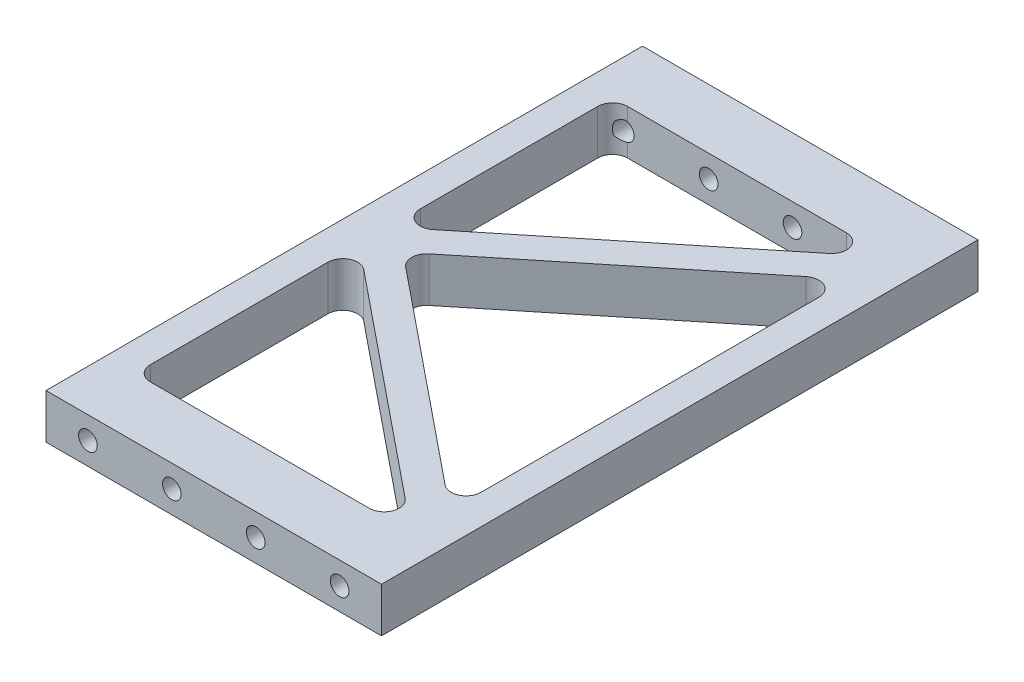
from build123d import *

# Parameters (mm, degrees)
SKETCH_1_W          = 45
SKETCH_1_H          = 80
EXTRUDE_1_DEPTH     = 6
CUT_EXTRUDE_2_DEPTH = 84.320165626
FILLET_10_R         = 2
M3X0_52_D           = 2.5
M3X0_52_DEPTH       = 8.5
M3X0_52_TIP         = 0.751075774
M3X0_51_D           = 2.5
M3X0_51_DEPTH       = 8.5
M3X0_51_TIP         = 0.751075774


with BuildPart() as part:
    # Эскиз1 → Бобышка-Вытянуть1 (new body)
    with BuildSketch(Plane(origin=(0, 0, 0), x_dir=(1, 0, 0), z_dir=(0, 1, 0))):
        with Locations((0, -40)):
            Rectangle(SKETCH_1_W, SKETCH_1_H)
    extrude(amount=EXTRUDE_1_DEPTH)

    # Эскиз13 → Вырез-Вытянуть2 (cut, through all)
    with BuildSketch(Plane(origin=(0, 6, 0), x_dir=(1, 0, 0), z_dir=(0, 1, 0))):
        Polygon((-18.5, -8), (18.5, -8), (-18.5, -38), align=None)
        Polygon((18.5, -72), (-18.5, -42), (-18.5, -72), align=None)
        Polygon((18.5, -13.149623941), (-14.615463806, -40), (18.5, -66.850376059), align=None)
    extrude(amount=-CUT_EXTRUDE_2_DEPTH, mode=Mode.SUBTRACT)

    # Скругление10
    fillet_10_edges = [part.edges().sort_by_distance(p)[0] for p in [
        (18.5, 3, 72),
        (-18.5, 3, 72),
        (-18.5, 3, 42),
        (-18.5, 3, 38),
        (-18.5, 3, 8),
        (18.5, 3, 8),
        (18.5, 3, 13.149623941),
        (18.5, 3, 66.850376059),
        (-14.615463806, 3, 40),
    ]]
    fillet(fillet_10_edges, radius=FILLET_10_R)

    # Отверстие обработанное метчиком M3x0.52
    with Locations(Plane(origin=(0, 0, 0), x_dir=(-1, 0, 0), z_dir=(0, 0, -1))):
        with Locations((-16.875, 3), (-5.625, 3), (5.625, 3), (16.875, 3)):
            Hole(M3X0_52_D / 2, depth=M3X0_52_DEPTH)
            with Locations((0, 0, -(M3X0_52_DEPTH + M3X0_52_TIP / 2))):  # 118° drill point
                Cone(0, M3X0_52_D / 2, M3X0_52_TIP, mode=Mode.SUBTRACT)

    # Отверстие обработанное метчиком M3x0.51
    with Locations(Plane.XY.offset(80)):
        with Locations((-16.875, 3), (-5.625, 3), (5.625, 3), (16.875, 3)):
            Hole(M3X0_51_D / 2, depth=M3X0_51_DEPTH)
            with Locations((0, 0, -(M3X0_51_DEPTH + M3X0_51_TIP / 2))):  # 118° drill point
                Cone(0, M3X0_51_D / 2, M3X0_51_TIP, mode=Mode.SUBTRACT)


solid = part.part
